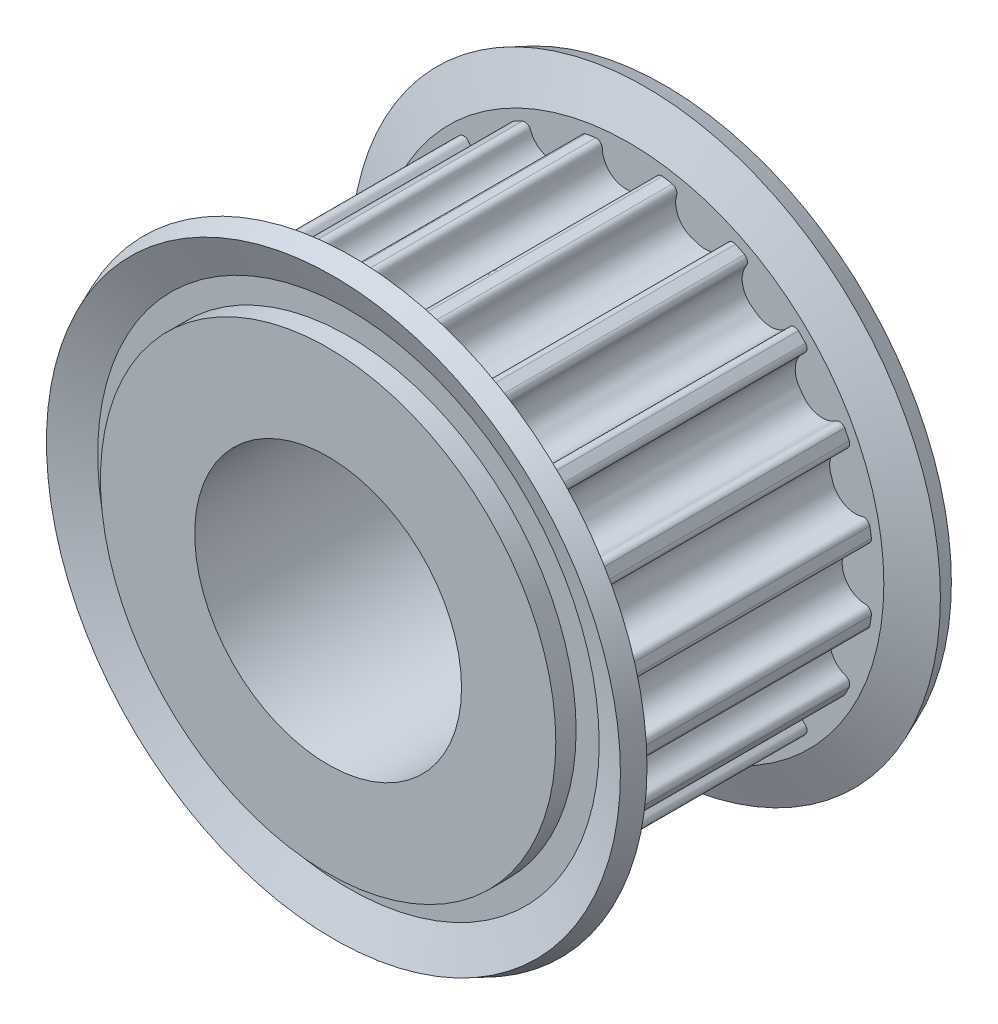
from build123d import *

# Parameters (mm, degrees)
TOOTHEXTRUDECUTGEARBELT01_DEPTH = 4.876799927
PATTERNGEARBELT01_COUNT         = 20
BOREREVOLVESKETCH_W             = 12.801599808
BOREREVOLVESKETCH_H             = 5


with BuildPart() as part:
    # SketchRevolveGearBelt01 → GearBelt01 (revolve)
    with BuildSketch(Plane(origin=(0, 0, 0), x_dir=(0, 0, -1), z_dir=(1, 0, 0))):
        Polygon((6.400799904, 0), (6.400799904, 8.53261095), (5.638799915, 8.53261095), (5.638799915, 9.397039713), (6.201536555, 10.755606141), (5.497540362, 11.047210912), (4.876799927, 9.548610935), (4.876799927, 9.16761094), (-4.876799927, 9.16761094), (-4.876799927, 9.548610935), (-5.497540362, 11.047210912), (-6.201536555, 10.755606141), (-5.638799915, 9.397039713), (-5.638799915, 8.53261095), (-6.400799904, 8.53261095), (-6.400799904, 0), align=None)
    revolve(axis=Axis((0, 0, 0), (0, 0, -1)))

    # SketchToothGearBelt01 → ToothExtrudeCutGearBelt01 (cut, symmetric)
    with BuildSketch(Plane.XY):
        with BuildLine():
            ThreePointArc((9.080869201, 1.261443793), (9.168065548, 0), (9.080869201, -1.261443793))
            add(Edge.make_bspline(
                [(9.080869201, -1.261443793), (9.082662513, -1.24854463), (9.083693408, -1.228966067), (9.081733826, -1.202969887), (9.078608457, -1.183668863), (9.073849952, -1.164704306), (9.067492966, -1.146214136), (9.059583715, -1.128332821), (9.050179723, -1.111190399), (9.039349378, -1.094911538), (9.027171443, -1.079614622), (9.01373448, -1.065410906), (8.99913621, -1.052403646), (8.983482788, -1.040687583), (8.966888093, -1.030347374), (8.949472647, -1.02146025), (8.931363708, -1.014083265), (8.912690705, -1.008298333), (8.8935979, -1.004042045), (8.8349227, -0.997078433), (8.758797506, -0.9959852), (8.668115139, -0.976671733), (8.601008495, -0.957794837), (8.535621705, -0.933456971), (8.47233254, -0.904143087), (8.411536258, -0.869943409), (8.353604663, -0.831092136), (8.298894136, -0.787821511), (8.24774069, -0.740399112), (8.200458629, -0.68911583), (8.15733846, -0.634286866), (8.118645028, -0.576249048), (8.084616363, -0.515358957), (8.055460395, -0.451990704), (8.031360492, -0.386533555), (8.012448905, -0.319389892), (7.998900848, -0.250971402), (7.990579277, -0.18170154), (7.988502837, -0.116556682), (7.988958614, -0.056000917), (7.98881813, 0), (7.988958614, 0.056000917), (7.988502837, 0.116556682), (7.990579277, 0.18170154), (7.998900848, 0.250971402), (8.012448905, 0.319389892), (8.031360492, 0.386533555), (8.055460395, 0.451990704), (8.084616363, 0.515358957), (8.118645028, 0.576249048), (8.15733846, 0.634286866), (8.200458629, 0.68911583), (8.24774069, 0.740399112), (8.298894136, 0.787821511), (8.353604663, 0.831092136), (8.411536258, 0.869943409), (8.47233254, 0.904143087), (8.535621705, 0.933456971), (8.601008495, 0.957794837), (8.668115139, 0.976671733), (8.758797506, 0.9959852), (8.8349227, 0.997078433), (8.8935979, 1.004042045), (8.912690705, 1.008298333), (8.931363708, 1.014083265), (8.949472647, 1.02146025), (8.966888093, 1.030347374), (8.983482788, 1.040687583), (8.99913621, 1.052403646), (9.01373448, 1.065410906), (9.027171443, 1.079614622), (9.039349378, 1.094911538), (9.050179723, 1.111190399), (9.059583715, 1.128332821), (9.067492966, 1.146214136), (9.073849952, 1.164704306), (9.078608457, 1.183668863), (9.081733826, 1.202969887), (9.083693408, 1.228966067), (9.082662513, 1.24854463), (9.080869201, 1.261443793)],
                knots=[0, 0, 0, 0, 0.010413034, 0.015619551, 0.020826068, 0.026032585, 0.031239102, 0.03644562, 0.041652137, 0.046858654, 0.052065171, 0.057271688, 0.062478205, 0.067684722, 0.072891239, 0.078097756, 0.083304273, 0.08851079, 0.093717307, 0.098923825, 0.135739015, 0.154316842, 0.172894669, 0.191472497, 0.210050324, 0.228628151, 0.247205978, 0.265783806, 0.284361633, 0.30293946, 0.321517287, 0.340095114, 0.358672942, 0.377250769, 0.395828596, 0.414406423, 0.43298425, 0.451562078, 0.470139905, 0.485069952, 0.5, 0.514930048, 0.529860095, 0.548437922, 0.56701575, 0.585593577, 0.604171404, 0.622749231, 0.641327058, 0.659904886, 0.678482713, 0.69706054, 0.715638367, 0.734216194, 0.752794022, 0.771371849, 0.789949676, 0.808527503, 0.827105331, 0.845683158, 0.864260985, 0.901076175, 0.906282693, 0.91148921, 0.916695727, 0.921902244, 0.927108761, 0.932315278, 0.937521795, 0.942728312, 0.947934829, 0.953141346, 0.958347863, 0.96355438, 0.968760898, 0.973967415, 0.979173932, 0.984380449, 0.989586966, 1, 1, 1, 1], degree=3))
        make_face()
    toothextrudecutgearbelt01 = extrude(amount=TOOTHEXTRUDECUTGEARBELT01_DEPTH, both=True, mode=Mode.SUBTRACT)

    # PatternGearBelt01: ToothExtrudeCutGearBelt01 ×20 about axis
    patterngearbelt01_axis = Axis((0, 0, 55), (0, 0, -1))
    for i in range(1, PATTERNGEARBELT01_COUNT):
        add(toothextrudecutgearbelt01.rotate(patterngearbelt01_axis, i * 360 / PATTERNGEARBELT01_COUNT), mode=Mode.SUBTRACT)

    # BoreRevolveSketch → BoreRevolveCut (revolve, cut)
    with BuildSketch(Plane(origin=(0, 0, 0), x_dir=(0, 0, -1), z_dir=(1, 0, 0))):
        with Locations((0, 2.5)):
            Rectangle(BOREREVOLVESKETCH_W, BOREREVOLVESKETCH_H)
    revolve(axis=Axis((0, 0, 0), (0, 0, -1)), mode=Mode.SUBTRACT)


solid = part.part
